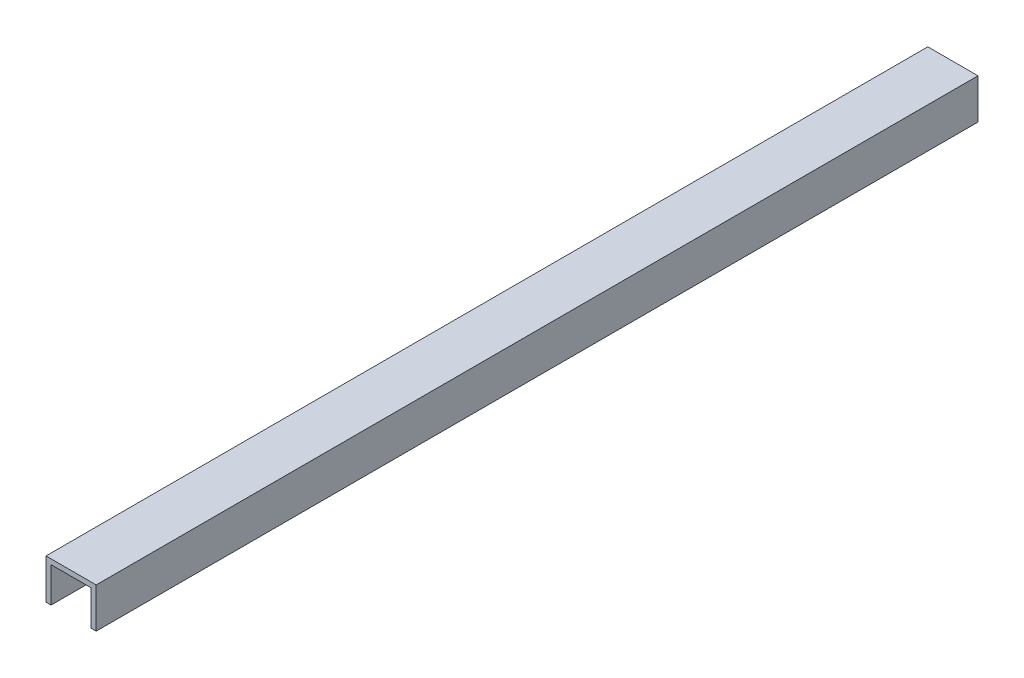
from build123d import *

# Parameters (mm, degrees)
BOSS_EXTRUDE1_DEPTH = 279.4


with BuildPart() as part:
    # Sketch1 → Boss-Extrude1 (new body)
    with BuildSketch(Plane.XY):
        Polygon((14.3002, 0), (15.9004, 0), (15.9004, 12.7), (0, 12.7), (0, 0), (1.6002, 0), (1.6002, 11.0998), (14.3002, 11.0998), align=None)
    extrude(amount=-BOSS_EXTRUDE1_DEPTH)


solid = part.part
